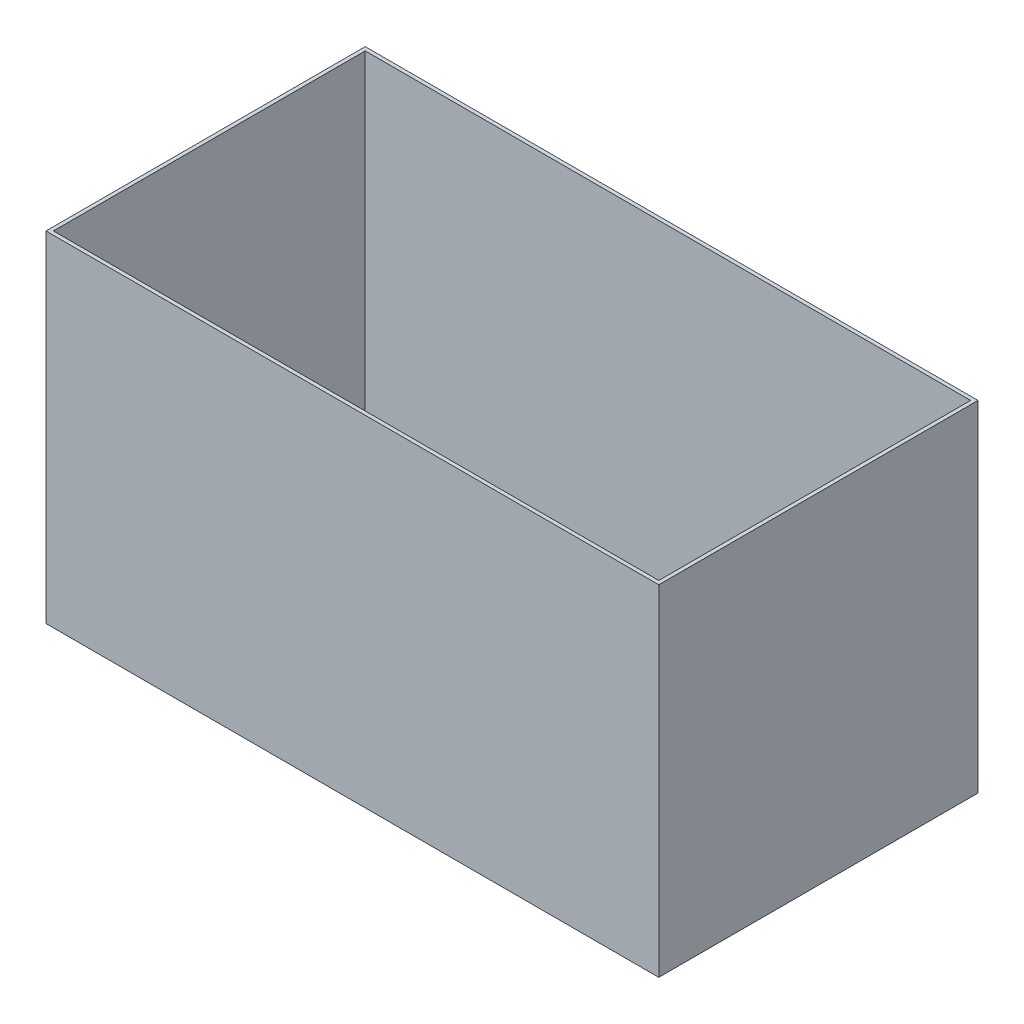
from build123d import *

# Parameters (mm, degrees)
SKETCH1_W           = 990
SKETCH1_H           = 510
BOSS_EXTRUDE3_DEPTH = 550
SHELL4_T            = 6


with BuildPart() as part:
    # Sketch1 → Boss-Extrude3 (new body)
    with BuildSketch(Plane(origin=(0, 0, 0), x_dir=(1, 0, 0), z_dir=(0, 1, 0))):
        with Locations((263.681387266, 298.187484375)):
            Rectangle(SKETCH1_W, SKETCH1_H)
    extrude(amount=BOSS_EXTRUDE3_DEPTH)

    # Shell4
    shell4_openings = [part.faces().sort_by_distance(p)[0] for p in [
        (263.681387266, 550, -298.187484375),
    ]]
    offset(amount=SHELL4_T, openings=shell4_openings, kind=Kind.INTERSECTION)


solid = part.part
